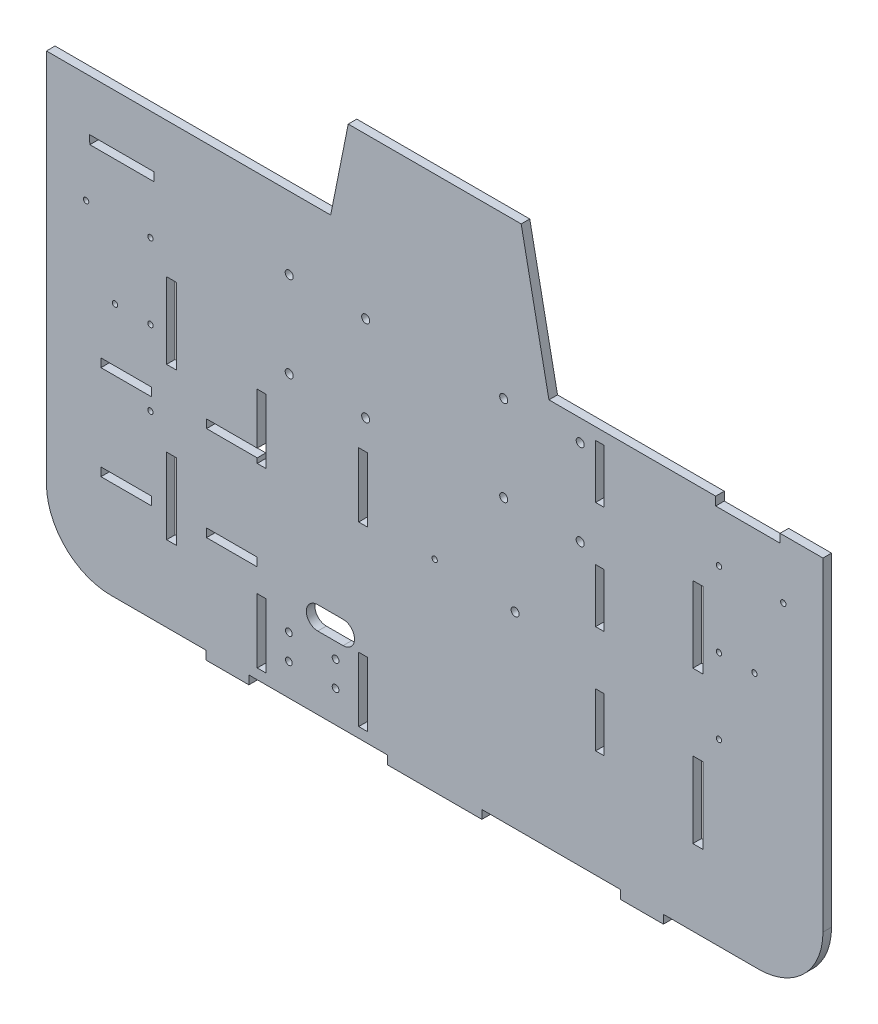
from build123d import *

# Parameters (mm, degrees)
SKETCH2_R           = 3.175
SKETCH2_R_2         = 4.7625
SKETCH2_R_3         = 4
SKETCH2_W           = 11.850089675
SKETCH2_H           = 89.916
SKETCH2_W_2         = 60
SKETCH2_H_2         = 10
SKETCH2_W_3         = 10.16
SKETCH2_H_3         = 63.685061478
SKETCH2_H_4         = 63.685061479
SKETCH2_H_5         = 76.2
BOSS_EXTRUDE1_DEPTH = 10.16
SKETCH4_W           = 351.675616699
SKETCH4_H           = 10.16
BOSS_EXTRUDE2_DEPTH = 60.261226


with BuildPart() as part:
    # Sketch2 → Boss-Extrude1 (new body)
    with BuildSketch(Plane.XY):
        with BuildLine():
            Line((-408.921789204, 152.75736057), (-459.721789204, 152.75736057))
            Line((-459.721789204, 152.75736057), (-459.721789204, -230.782639429))
            ThreePointArc((-459.721789204, -230.782639429), (-437.403325931, -284.664176156), (-383.521789204, -306.982639429))
            Line((-383.521789204, -306.982639429), (-303.52, -306.982639429))
            Line((-303.52, -306.982639429), (-270.8, -306.982639429))
            Line((-270.8, -306.982639429), (-270.8, -317.142639429))
            Line((-270.8, -317.142639429), (-220, -317.142639429))
            Line((-220, -317.142639429), (-220, -306.982639429))
            Line((-220, -306.982639429), (-55.8292, -306.982639429))
            Line((-55.8292, -306.982639429), (-55.8292, -317.142639429))
            Line((-55.8292, -317.142639429), (55.8292, -317.142639429))
            Line((55.8292, -317.142639429), (55.8292, -306.982639429))
            Line((55.8292, -306.982639429), (220, -306.982639429))
            Line((220, -306.982639429), (220, -317.142639429))
            Line((220, -317.142639429), (270.8, -317.142639429))
            Line((270.8, -317.142639429), (270.8, -306.982639429))
            Line((270.8, -306.982639429), (303.52, -306.982639429))
            Line((303.52, -306.982639429), (383.521789204, -306.982639429))
            ThreePointArc((383.521789204, -306.982639429), (437.403325931, -284.664176156), (459.721789204, -230.782639429))
            Line((459.721789204, -230.782639429), (459.721789204, 152.75736057))
            Line((459.721789204, 152.75736057), (408.921789204, 152.75736057))
            Line((408.921789204, 152.75736057), (408.921789204, 142.616356263))
            Line((408.921789204, 142.616356263), (332.721789204, 142.616356263))
            Line((332.721789204, 142.616356263), (332.721789204, 152.75736057))
            Line((332.721789204, 152.75736057), (135.250547773, 152.75736057))
            Line((135.250547773, 152.75736057), (102.394461083, 316.728644457))
            Line((102.394461083, 316.728644457), (-102.394461083, 316.728644457))
            Line((-102.394461083, 316.728644457), (-135.250547773, 152.75736057))
            Line((-135.250547773, 152.75736057), (-332.100796745, 152.75736057))
            Line((-332.100796745, 152.75736057), (-332.100796745, 142.616356263))
            Line((-332.100796745, 142.616356263), (-408.300796745, 142.616356263))
            Line((-408.300796745, 142.616356263), (-408.921789204, 152.75736057))
        make_face()
        with Locations((336.550272189, -94.687385458)):
            Circle(SKETCH2_R, mode=Mode.SUBTRACT)
        with Locations((378.573819589, -5.78737531)):
            Circle(SKETCH2_R, mode=Mode.SUBTRACT)
        with Locations((336.550272189, -5.787385458)):
            Circle(SKETCH2_R, mode=Mode.SUBTRACT)
        with Locations((336.550272189, 83.112614542)):
            Circle(SKETCH2_R, mode=Mode.SUBTRACT)
        with Locations((412.750272189, 83.112614542)):
            Circle(SKETCH2_R, mode=Mode.SUBTRACT)
        with Locations((-412.75027219, 83.112614542)):
            Circle(SKETCH2_R, mode=Mode.SUBTRACT)
        with Locations((-336.55027219, 83.112614542)):
            Circle(SKETCH2_R, mode=Mode.SUBTRACT)
        with Locations((-336.55027219, -5.787385458)):
            Circle(SKETCH2_R, mode=Mode.SUBTRACT)
        with Locations((-378.573819589, -5.78737531)):
            Circle(SKETCH2_R, mode=Mode.SUBTRACT)
        with Locations((-336.55027219, -94.687385458)):
            Circle(SKETCH2_R, mode=Mode.SUBTRACT)
        with Locations((172.2755, 127.35736057)):
            Circle(SKETCH2_R_2, mode=Mode.SUBTRACT)
        with Locations((172.2755, 25.75736057)):
            Circle(SKETCH2_R_2, mode=Mode.SUBTRACT)
        with Locations((81.7245, 25.75736057)):
            Circle(SKETCH2_R_2, mode=Mode.SUBTRACT)
        with Locations((81.7245, 127.35736057)):
            Circle(SKETCH2_R_2, mode=Mode.SUBTRACT)
        with Locations((-81.7245, 25.75736057)):
            Circle(SKETCH2_R_2, mode=Mode.SUBTRACT)
        with Locations((-81.7245, 127.35736057)):
            Circle(SKETCH2_R_2, mode=Mode.SUBTRACT)
        with Locations((-172.2755, 127.35736057)):
            Circle(SKETCH2_R_2, mode=Mode.SUBTRACT)
        with Locations((-172.2755, 25.75736057)):
            Circle(SKETCH2_R_2, mode=Mode.SUBTRACT)
        with Locations((0, -78.38263943)):
            Circle(SKETCH2_R, mode=Mode.SUBTRACT)
        with Locations((95.25, -84.73263943)):
            Circle(SKETCH2_R_2, mode=Mode.SUBTRACT)
        with Locations((-172.69, -239.442639429)):
            Circle(SKETCH2_R_3, mode=Mode.SUBTRACT)
        with Locations((-117.38, -239.442639429)):
            Circle(SKETCH2_R_3, mode=Mode.SUBTRACT)
        with Locations((-117.38, -269.442639429)):
            Circle(SKETCH2_R_3, mode=Mode.SUBTRACT)
        with Locations((-172.69, -269.442639429)):
            Circle(SKETCH2_R_3, mode=Mode.SUBTRACT)
        with Locations((311.557332494, 7.72336057)):
            Rectangle(SKETCH2_W, SKETCH2_H, mode=Mode.SUBTRACT)
        with Locations((311.557332494, -172.10863943)):
            Rectangle(SKETCH2_W, SKETCH2_H, mode=Mode.SUBTRACT)
        with Locations((-365.16, -74.446988355)):
            Rectangle(SKETCH2_W_2, SKETCH2_H_2, mode=Mode.SUBTRACT)
        Polygon((-270.16, -79.446988355), (-210.16, -79.446988355), (-210.16, -85.16237531), (-200, -85.16237531), (-200, -8.96237531), (-210.16, -8.96237531), (-210.16, -69.446988355), (-270.16, -69.446988355), align=None, mode=Mode.SUBTRACT)
        with Locations((195.58, -147.752560311)):
            Rectangle(SKETCH2_W_3, SKETCH2_H_3, mode=Mode.SUBTRACT)
        with Locations((195.58, -20.382437355)):
            Rectangle(SKETCH2_W_3, SKETCH2_H_4, mode=Mode.SUBTRACT)
        with Locations((195.58, 106.97026018)):
            Rectangle(SKETCH2_W_3, SKETCH2_H_4, mode=Mode.SUBTRACT)
        with Locations((-205.08, -256.782661115)):
            Rectangle(SKETCH2_W_3, SKETCH2_H_5, mode=Mode.SUBTRACT)
        with Locations((-240.16, -186.254154613)):
            Rectangle(SKETCH2_W_2, SKETCH2_H_2, mode=Mode.SUBTRACT)
        with Locations((-365.16, -186.254154613)):
            Rectangle(SKETCH2_W_2, SKETCH2_H_2, mode=Mode.SUBTRACT)
        with Locations((-311.557332494, -172.10863943)):
            Rectangle(SKETCH2_W, SKETCH2_H, mode=Mode.SUBTRACT)
        with Locations((-84.92, -256.782661115)):
            Rectangle(SKETCH2_W_3, SKETCH2_H_5, mode=Mode.SUBTRACT)
        with Locations((-84.92, -47.06237531)):
            Rectangle(SKETCH2_W_3, SKETCH2_H_5, mode=Mode.SUBTRACT)
        with Locations((-311.557332494, 7.72336057)):
            Rectangle(SKETCH2_W, SKETCH2_H, mode=Mode.SUBTRACT)
        with BuildLine():
            Line((-108.5, -221.170881029), (-138.5, -221.170881029))
            ThreePointArc((-138.5, -221.170881029), (-152, -207.670881029), (-138.5, -194.170881029))
            Line((-138.5, -194.170881029), (-108.5, -194.170881029))
            ThreePointArc((-108.5, -194.170881029), (-95, -207.670881029), (-108.5, -221.170881029))
        make_face(mode=Mode.SUBTRACT)
    extrude(amount=-BOSS_EXTRUDE1_DEPTH)

    # Sketch4 → Boss-Extrude2 (add)
    with BuildSketch(Plane(origin=(0, 152.75736057, 0), x_dir=(1, 0, 0), z_dir=(0, 1, 0))):
        with Locations((-283.883980855, 5.08)):
            Rectangle(SKETCH4_W, SKETCH4_H)
    extrude(amount=BOSS_EXTRUDE2_DEPTH)


solid = part.part
